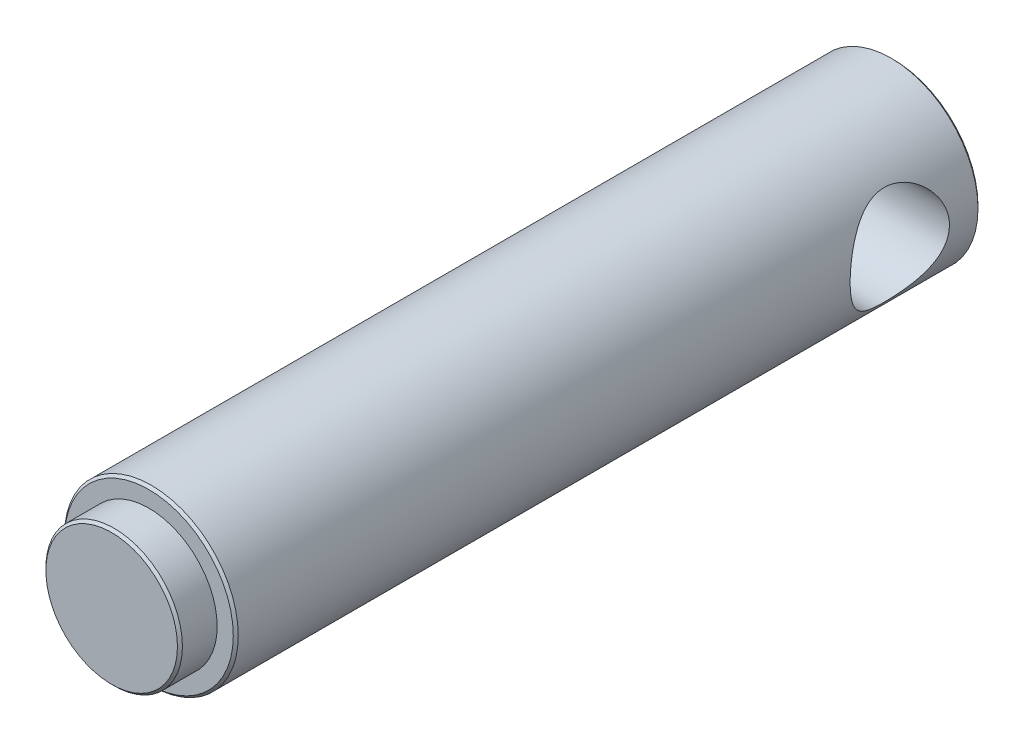
from build123d import *

# Parameters (mm, degrees)
SKIZZE1_R                            = 7
AUFSATZ_LINEAR_AUSTRAGEN1_DEPTH      = 60
SKIZZE2_R                            = 5.5
AUFSATZ_LINEAR_AUSTRAGEN2_DEPTH      = 3
SCHNITT_LINEAR_AUSTRAGEN2_DEPTH      = 64.773035054
SCHNITT_LINEAR_AUSTRAGEN2_DEPTH_BACK = 64.773035054
SKIZZE4_R                            = 4
FASE1_SIZE                           = 0.2


with BuildPart() as part:
    # Skizze1 → Aufsatz-Linear austragen1 (new body)
    with BuildSketch(Plane.XY):
        Circle(SKIZZE1_R)
    extrude(amount=AUFSATZ_LINEAR_AUSTRAGEN1_DEPTH)

    # Skizze2 → Aufsatz-Linear austragen2 (add)
    with BuildSketch(Plane.XY.offset(60)):
        Circle(SKIZZE2_R)
    extrude(amount=AUFSATZ_LINEAR_AUSTRAGEN2_DEPTH)

    # Skizze4 → Schnitt-Linear austragen2 (cut, two sides: drawn at the far end of the back side and taken through both)
    with BuildSketch(Plane(origin=(0, 0, 0), x_dir=(0, 0, -1), z_dir=(1, 0, 0)).offset(-SCHNITT_LINEAR_AUSTRAGEN2_DEPTH_BACK)):
        with Locations((-6.5, 0)):
            Circle(SKIZZE4_R)
    extrude(amount=SCHNITT_LINEAR_AUSTRAGEN2_DEPTH + SCHNITT_LINEAR_AUSTRAGEN2_DEPTH_BACK, mode=Mode.SUBTRACT)

    # Fase1
    fase1_edges = [part.edges().sort_by_distance(p)[0] for p in [
        (-7, 0, 0),
        (-7, 0, 60),
        (-5.5, 0, 63),
    ]]
    chamfer(fase1_edges, length=FASE1_SIZE)


solid = part.part
